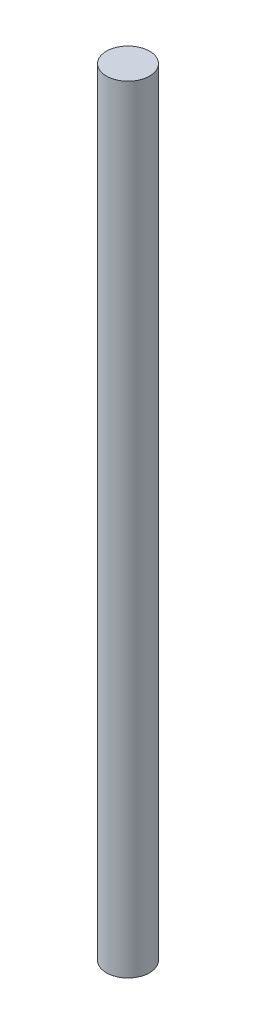
from build123d import *

# Parameters (mm, degrees)
SKETCH_1_R      = 3
EXTRUDE_1_DEPTH = 108


with BuildPart() as part:
    # 草图1 → 凸台-拉伸1 (new body)
    with BuildSketch(Plane(origin=(0, 0, 0), x_dir=(1, 0, 0), z_dir=(0, 1, 0))):
        with Locations(Location((0, 0, 0), (0, 0, 270))):
            Circle(SKETCH_1_R)
    extrude(amount=EXTRUDE_1_DEPTH)


solid = part.part
